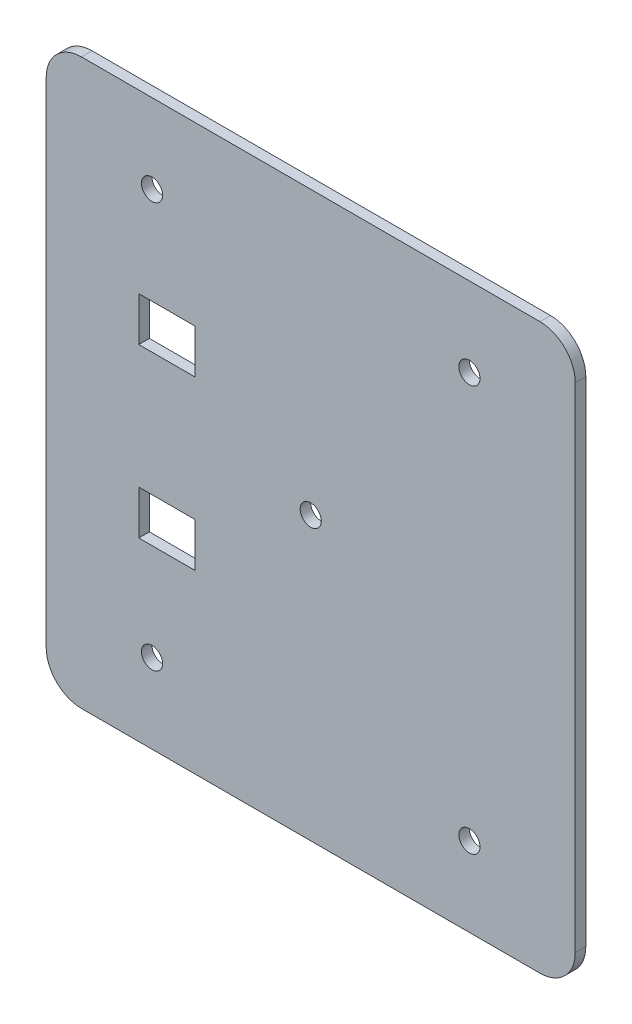
from build123d import *

# Parameters (mm, degrees)
SKETCH1_R           = 6
SKETCH1_W           = 32
SKETCH1_H           = 25
BOSS_EXTRUDE1_DEPTH = 6


with BuildPart() as part:
    # Sketch1 → Boss-Extrude1 (new body)
    with BuildSketch(Plane.XY):
        with BuildLine():
            Line((-55, -102.5), (205, -102.5))
            ThreePointArc((205, -102.5), (219.142135624, -96.642135624), (225, -82.5))
            Line((225, -82.5), (225, 197.5))
            ThreePointArc((225, 197.5), (219.142135624, 211.642135624), (205, 217.5))
            Line((205, 217.5), (-55, 217.5))
            ThreePointArc((-55, 217.5), (-69.142135624, 211.642135624), (-75, 197.5))
            Line((-75, 197.5), (-75, -82.5))
            ThreePointArc((-75, -82.5), (-69.142135624, -96.642135624), (-55, -102.5))
        make_face()
        with Locations((165, 172.5)):
            Circle(SKETCH1_R, mode=Mode.SUBTRACT)
        with Locations((-15, -57.5)):
            Circle(SKETCH1_R, mode=Mode.SUBTRACT)
        Polygon((9.5, 22.5), (9.5, -2.5), (-22.5, -2.5), (-22.5, 22.5), (0, 22.5), align=None, mode=Mode.SUBTRACT)
        with Locations((165, -57.5)):
            Circle(SKETCH1_R, mode=Mode.SUBTRACT)
        with Locations((-6.5, 105)):
            Rectangle(SKETCH1_W, SKETCH1_H, mode=Mode.SUBTRACT)
        with Locations((-15, 172.5)):
            Circle(SKETCH1_R, mode=Mode.SUBTRACT)
        with Locations((75, 57.5)):
            Circle(SKETCH1_R, mode=Mode.SUBTRACT)
    extrude(amount=BOSS_EXTRUDE1_DEPTH)


solid = part.part
